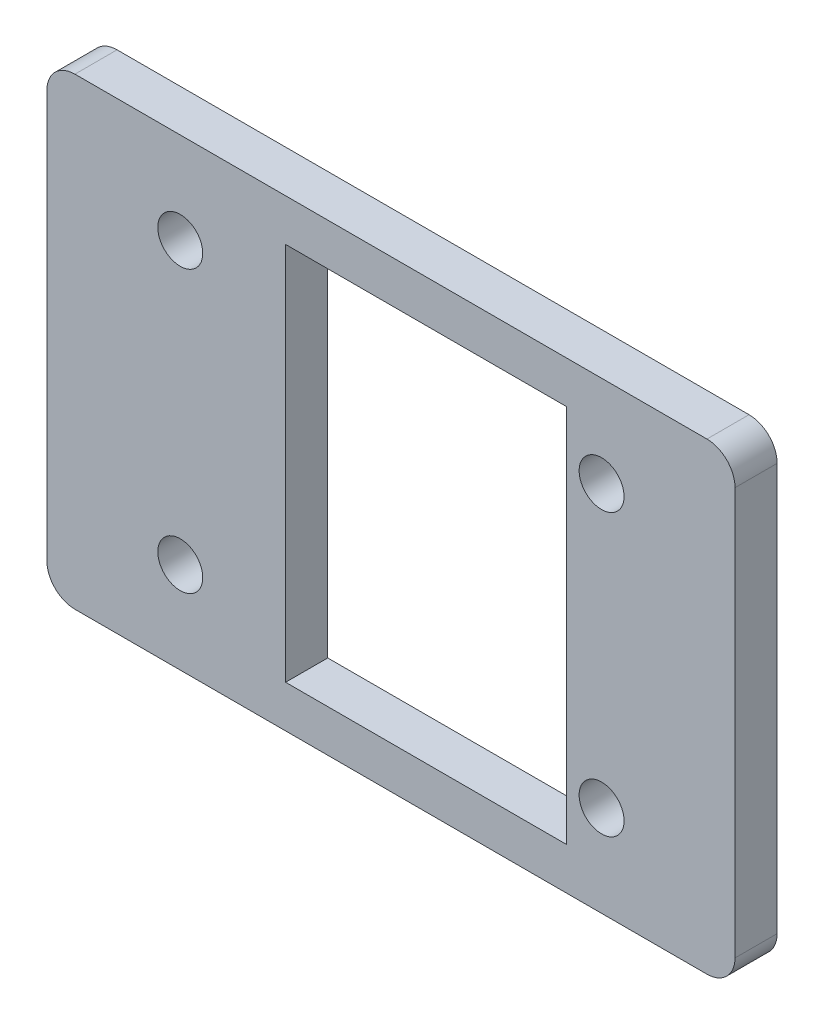
from build123d import *

# Parameters (mm, degrees)
SKETCH1_W           = 49
SKETCH1_H           = 33
SKETCH1_R           = 1.6
BOSS_EXTRUDE2_DEPTH = 3
FILLET1_R           = 2
SKETCH2_W           = 20
SKETCH2_H           = 27
CUT_EXTRUDE1_DEPTH  = 10


with BuildPart() as part:
    # Sketch1 → Boss-Extrude2 (new body)
    with BuildSketch(Plane.XY):
        with Locations((5.332147937, -0.241820768)):
            Rectangle(SKETCH1_W, SKETCH1_H)
        with Locations((-9.667852063, 9.758179232)):
            Circle(SKETCH1_R, mode=Mode.SUBTRACT)
        with Locations((20.332147937, 9.758179232)):
            Circle(SKETCH1_R, mode=Mode.SUBTRACT)
        with Locations((-9.667852063, -10.241820768)):
            Circle(SKETCH1_R, mode=Mode.SUBTRACT)
        with Locations((20.332147937, -10.241820768)):
            Circle(SKETCH1_R, mode=Mode.SUBTRACT)
    extrude(amount=BOSS_EXTRUDE2_DEPTH)

    # Fillet1
    fillet1_edges = [part.edges().sort_by_distance(p)[0] for p in [
        (-19.167852063, 16.258179232, 1.5),
        (29.832147937, 16.258179232, 1.5),
        (29.832147937, -16.741820768, 1.5),
        (-19.167852063, -16.741820768, 1.5),
    ]]
    fillet(fillet1_edges, radius=FILLET1_R)

    # Sketch2 → Cut-Extrude1 (cut)
    with BuildSketch(Plane.XY.offset(3)):
        with Locations((7.832147937, -0.241820768)):
            Rectangle(SKETCH2_W, SKETCH2_H)
    extrude(amount=-CUT_EXTRUDE1_DEPTH, mode=Mode.SUBTRACT)


solid = part.part
